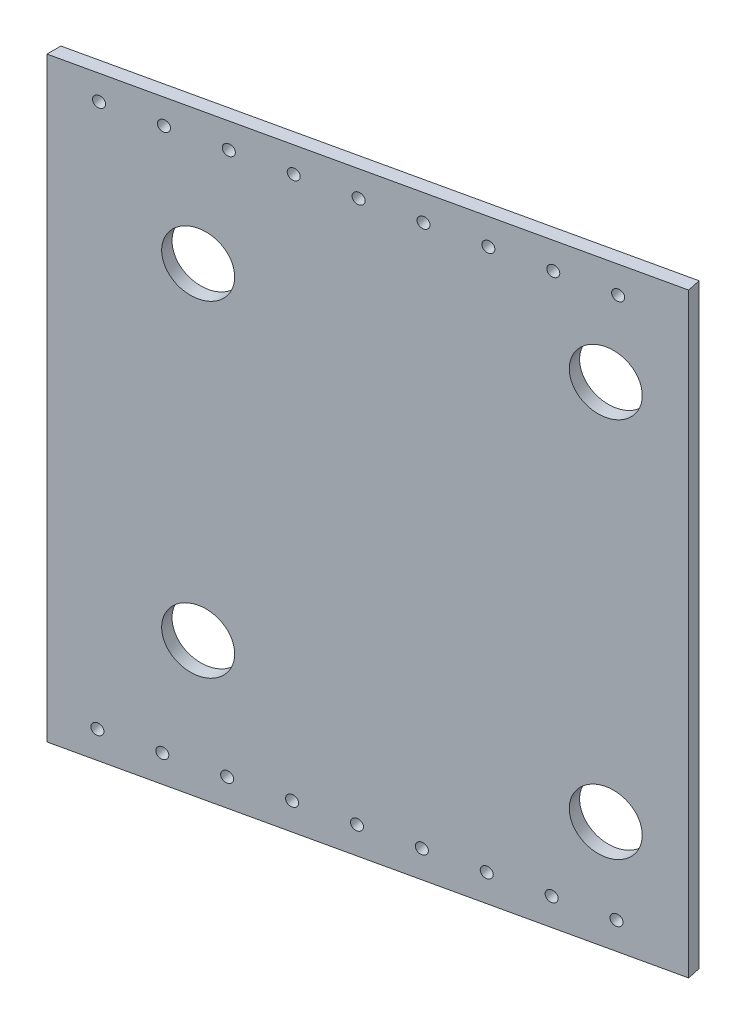
from build123d import *

# Parameters (mm, degrees)
SKETCH1_W                      = 278.13
SKETCH1_H                      = 251.191235252
BOSS_EXTRUDE1_DEPTH            = 6.35
DRAFT1_ANGLE                   = -12.5
HOLE1_D                        = 28.575
HOLE1_DEPTH                    = 59.131528827
F_7_0_201_DIAMETER_HOLE1_D     = 5.1054
F_7_0_201_DIAMETER_HOLE1_DEPTH = 59.131528827


with BuildPart() as part:
    # Sketch1 → Boss-Extrude1 (new body)
    with BuildSketch(Plane(origin=(191.25417179, 0, 862.691819056), x_dir=(0, 1, 0), z_dir=(0.21643961393810301, 0, 0.9762960071199335))):
        with Locations((145.415, -415.039419658)):
            Rectangle(SKETCH1_W, SKETCH1_H)
    extrude(amount=-BOSS_EXTRUDE1_DEPTH)

    # Draft1
    draft1_faces = [part.faces().sort_by_distance(p)[0] for p in [
        (473.149804226, 145.415, 796.944974464),
    ]]
    draft(draft1_faces, Plane(origin=(191.25417179, 0, 862.691819056), x_dir=(0.9762960071199334, 0, -0.21643961393810301), z_dir=(0.216439613938103, 0, 0.9762960071199333)), DRAFT1_ANGLE)

    # Hole1
    with Locations(Plane(origin=(191.25417179, 0, 862.691819056), x_dir=(0.976296007119934, 0, -0.21643961393809993), z_dir=(0.21643961393809993, 0, 0.9762960071199341))):
        with Locations((348.630068619, 222.25), (508.166081715, 234.95), (508.166081715, 57.15), (348.630068619, 69.85)):
            Hole(HOLE1_D / 2, depth=HOLE1_DEPTH)

    # #7 (0.201) Diameter Hole1
    with Locations(Plane(origin=(191.25417179, 0, 862.691819056), x_dir=(0.9762960071199334, 0, -0.216439613938103), z_dir=(0.21643961393810301, 0, 0.9762960071199335))):
        with Locations((360.623802339, 272.691741315), (411.423153063, 272.434902784), (462.222503787, 272.178064254), (513.02185451, 271.921225723), (487.622179149, 272.049644989), (436.822828425, 272.306483519), (386.023477701, 272.563322049), (335.224126977, 272.82016058), (512.382607571, 19.05), (486.982607571, 19.05), (461.582607571, 19.05), (436.182607571, 19.05), (410.782607571, 19.05), (385.382607571, 19.05), (359.982607571, 19.05), (334.582607571, 19.05), (309.182607571, 19.05), (309.824451615, 272.948579845)):
            Hole(F_7_0_201_DIAMETER_HOLE1_D / 2, depth=F_7_0_201_DIAMETER_HOLE1_DEPTH)


solid = part.part
